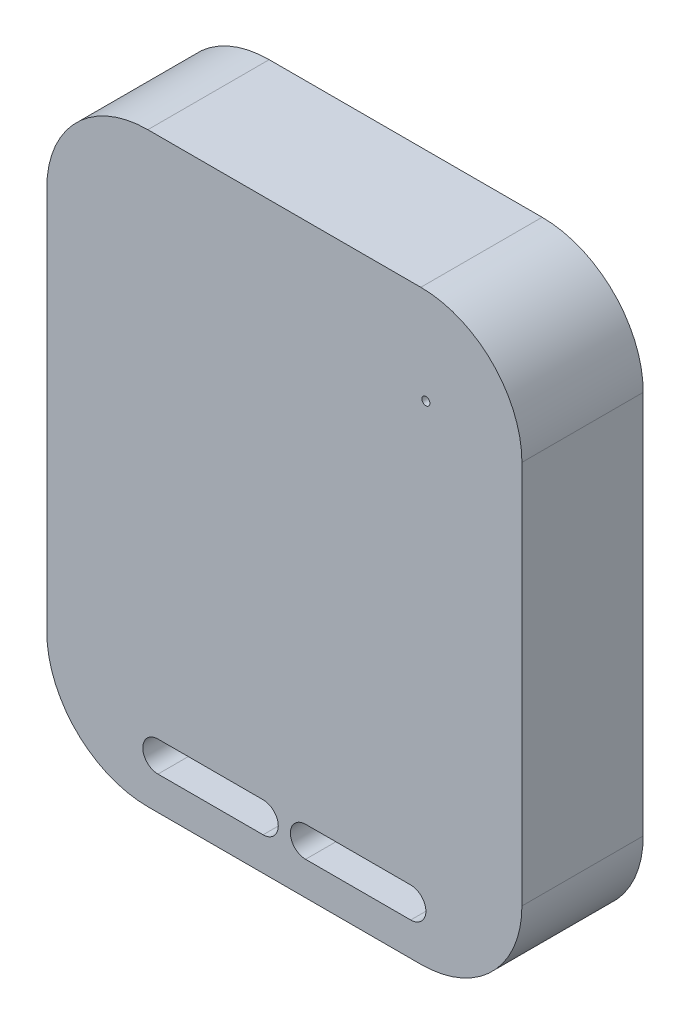
from build123d import *

# Parameters (mm, degrees)
POCKET_TAG_BODY_58X47X12_R10_DEPTH         = 12
LANYARD_SLOT_LEFT_REAL_DEPTH               = 12.5
LANYARD_SLOT_RIGHT_REAL_DEPTH              = 12.5
SKETCH_4_R                                 = 0.4
STATUS_LED_HOLE_REAL_DEPTH                 = 12.5
USB_C_SIDE_OPENING_9X3_2_AT_PCB_USB1_DEPTH = 5
DIRECTION_MARKER_RECESS_DEPTH              = 0.22
ENGRAVED_LOGO_POYU_DEPTH                   = 0.28
ENGRAVED_LOGO_POCKET_TAG_DEPTH             = 0.22


with BuildPart() as part:
    # 草图1 → Pocket_Tag_body_58x47x12_R10 (new body)
    with BuildSketch(Plane.XY):
        with BuildLine():
            Line((-13.5, 29), (13.5, 29))
            ThreePointArc((13.5, 29), (20.571067812, 26.071067812), (23.5, 19))
            Line((23.5, 19), (23.5, -19))
            ThreePointArc((23.5, -19), (20.571067812, -26.071067812), (13.5, -29))
            Line((13.5, -29), (-13.5, -29))
            ThreePointArc((-13.5, -29), (-20.571067812, -26.071067812), (-23.5, -19))
            Line((-23.5, -19), (-23.5, 19))
            ThreePointArc((-23.5, 19), (-20.571067812, 26.071067812), (-13.5, 29))
        make_face()
    extrude(amount=POCKET_TAG_BODY_58X47X12_R10_DEPTH)

    # 草图2 → Lanyard_slot_left_real (cut)
    with BuildSketch(Plane.XY):
        with BuildLine():
            Line((-12.5, -22.7), (-2.1, -22.7))
            ThreePointArc((-2.1, -22.7), (-0.6, -24.2), (-2.1, -25.7))
            Line((-2.1, -25.7), (-12.5, -25.7))
            ThreePointArc((-12.5, -25.7), (-14, -24.2), (-12.5, -22.7))
        make_face()
    extrude(amount=LANYARD_SLOT_LEFT_REAL_DEPTH, mode=Mode.SUBTRACT)

    # 草图3 → Lanyard_slot_right_real (cut)
    with BuildSketch(Plane.XY):
        with BuildLine():
            Line((2.1, -22.7), (12.5, -22.7))
            ThreePointArc((12.5, -22.7), (14, -24.2), (12.5, -25.7))
            Line((12.5, -25.7), (2.1, -25.7))
            ThreePointArc((2.1, -25.7), (0.6, -24.2), (2.1, -22.7))
        make_face()
    extrude(amount=LANYARD_SLOT_RIGHT_REAL_DEPTH, mode=Mode.SUBTRACT)

    # 草图4 → Status_LED_hole_real (cut)
    with BuildSketch(Plane.XY):
        with Locations(Location((14, 19.5, 0), (0, 0, 180))):
            Circle(SKETCH_4_R)
    extrude(amount=STATUS_LED_HOLE_REAL_DEPTH, mode=Mode.SUBTRACT)

    # 草图5 → USB_C_side_opening_9x3_2_at_PCB_USB1 (cut)
    with BuildSketch(Plane(origin=(0, 0, 0), x_dir=(-1, 0, 0), z_dir=(0, 0, -1))):
        with BuildLine():
            Line((-2.9, 1.6), (2.9, 1.6))
            ThreePointArc((2.9, 1.6), (4.5, 0), (2.9, -1.6))
            Line((2.9, -1.6), (-2.9, -1.6))
            ThreePointArc((-2.9, -1.6), (-4.5, 0), (-2.9, 1.6))
        make_face()
    extrude(amount=-USB_C_SIDE_OPENING_9X3_2_AT_PCB_USB1_DEPTH, mode=Mode.SUBTRACT)

    # 草图6 → Direction_marker_recess (cut)
    with BuildSketch(Plane.XY):
        Polygon((-19, 20.9), (-17.4, 21.7), (-17.4, 25.1), (-19, 24.3), align=None)
    extrude(amount=DIRECTION_MARKER_RECESS_DEPTH, mode=Mode.SUBTRACT)

    # 草图7 → Engraved_Logo_POYU (cut)
    # profile 1 of 4: a face of its own
    with BuildSketch(Plane.XY):
        with BuildLine():
            Line((-6.623076923, 2.8), (-6.623076923, 7.8))
            Line((-6.623076923, 7.8), (-4.786137821, 7.8))
            add(Edge.make_bspline(
                [(-4.786137821, 7.8), (-4.709998175, 7.799566226), (-4.567007564, 7.798751597), (-4.367323014, 7.789211242), (-4.195850647, 7.777408243), (-4.092280648, 7.760603842), (-4.044951923, 7.752924679)],
                knots=[0, 0, 0, 0, 1.22865052, 2.30741144, 3.226532197, 4, 4, 4, 4], degree=3))
            add(Edge.make_bspline(
                [(-4.044951923, 7.752924679), (-3.987222303, 7.741814485), (-3.875326209, 7.720279832), (-3.716898682, 7.668364453), (-3.572562028, 7.603759728), (-3.442541816, 7.523268906), (-3.32467801, 7.428711879), (-3.220650303, 7.315410364), (-3.128437593, 7.185894184), (-3.05002862, 7.040264678), (-2.984765165, 6.883567391), (-2.939054387, 6.716630562), (-2.909776551, 6.542354488), (-2.906694864, 6.4232502), (-2.905128205, 6.362700321)],
                knots=[0, 0, 0, 0, 1.070909925, 2.075721949, 3.031861647, 3.947440733, 4.85625699, 5.777986723, 6.742441087, 7.747548058, 8.78749499, 9.830146138, 10.896896232, 12, 12, 12, 12], degree=3))
            add(Edge.make_bspline(
                [(-2.905128205, 6.362700321), (-2.906232294, 6.310893866), (-2.90840465, 6.20896183), (-2.927058325, 6.059208957), (-2.956479203, 5.915140605), (-3.000364433, 5.777742655), (-3.054015305, 5.645408791), (-3.121627801, 5.520370854), (-3.20058012, 5.400930935), (-3.291162931, 5.287414041), (-3.397804058, 5.182123687), (-3.526106444, 5.092805522), (-3.673596405, 5.017803371), (-3.840308342, 4.957202445), (-4.025837558, 4.909519281), (-4.230791945, 4.874582505), (-4.45557076, 4.855294497), (-4.611822835, 4.852653783), (-4.692988782, 4.851282051)],
                knots=[0, 0, 0, 0, 0.928769099, 1.82740408, 2.702266355, 3.562020322, 4.410419678, 5.259600434, 6.10654066, 6.975254961, 7.860221694, 8.783881459, 9.766664779, 10.81996744, 11.958551584, 13.197863772, 14.544415867, 16, 16, 16, 16], degree=3))
            Line((-4.692988782, 4.851282051), (-5.917948718, 4.851282051))
            Line((-5.917948718, 4.851282051), (-5.917948718, 2.8))
            Line((-5.917948718, 2.8), (-6.623076923, 2.8))
        make_face()
        with BuildLine():
            Line((-5.917948718, 5.428205128), (-4.712019231, 5.428205128))
            add(Edge.make_bspline(
                [(-4.712019231, 5.428205128), (-4.663922024, 5.429009332), (-4.571267213, 5.430558555), (-4.437385236, 5.44136988), (-4.314514618, 5.460083783), (-4.202314525, 5.4861842), (-4.100642092, 5.518626269), (-4.00967923, 5.559656557), (-3.929895007, 5.608874719), (-3.860760753, 5.665779217), (-3.801416798, 5.729526138), (-3.749996672, 5.79907051), (-3.706307353, 5.874909307), (-3.67206009, 5.957359831), (-3.643047936, 6.04481826), (-3.624939115, 6.139096737), (-3.612348108, 6.238828087), (-3.610963419, 6.307569557), (-3.61025641, 6.342668269)],
                knots=[0, 0, 0, 0, 1.403696362, 2.704090955, 3.91683431, 5.027708188, 6.063065288, 7.026749679, 7.932587242, 8.790956304, 9.632005367, 10.468072405, 11.310475089, 12.179234342, 13.069796908, 13.994719932, 14.976123913, 16, 16, 16, 16], degree=3))
            add(Edge.make_bspline(
                [(-3.61025641, 6.342668269), (-3.611750062, 6.393567), (-3.614644238, 6.492190969), (-3.643803782, 6.634107823), (-3.689519786, 6.765241512), (-3.754971651, 6.883109263), (-3.834187445, 6.986510674), (-3.927303933, 7.071110049), (-4.031335773, 7.138744131), (-4.109010893, 7.165523929), (-4.148116987, 7.17900641)],
                knots=[0, 0, 0, 0, 1.143156811, 2.215038775, 3.243253804, 4.254666983, 5.233799895, 6.158487526, 7.072877374, 8, 8, 8, 8], degree=3))
            add(Edge.make_bspline(
                [(-4.148116987, 7.17900641), (-4.162438892, 7.182508432), (-4.193561377, 7.190118568), (-4.245115528, 7.198756186), (-4.304864074, 7.206935243), (-4.373098258, 7.212361666), (-4.449195801, 7.217750796), (-4.533389343, 7.22023505), (-4.625870676, 7.222380737), (-4.69031613, 7.222837771), (-4.724038462, 7.223076923)],
                knots=[0, 0, 0, 0, 0.611063981, 1.327884044, 2.165719042, 3.110592661, 4.16481496, 5.328235826, 6.601947678, 8, 8, 8, 8], degree=3))
            Line((-4.724038462, 7.223076923), (-5.917948718, 7.223076923))
            Line((-5.917948718, 7.223076923), (-5.917948718, 5.428205128))
        make_face(mode=Mode.SUBTRACT)
    # profile 2 of 4: a face of its own
    with BuildSketch(Plane.XY):
        with BuildLine():
            add(Edge.make_bspline(
                [(-2.264102564, 5.233894231), (-2.262364757, 5.334139921), (-2.258978727, 5.529463565), (-2.227341224, 5.813879959), (-2.17597004, 6.081478582), (-2.102530387, 6.332238585), (-2.009445416, 6.566552913), (-1.896282851, 6.784952134), (-1.759638838, 6.984964125), (-1.605059639, 7.168492871), (-1.432401773, 7.330745735), (-1.248570221, 7.474849524), (-1.051269501, 7.595049121), (-0.842322522, 7.694294361), (-0.620841558, 7.770491983), (-0.38744846, 7.823837251), (-0.14239284, 7.858250134), (0.025108411, 7.862123418), (0.110697115, 7.864102564)],
                knots=[0, 0, 0, 0, 1.203621547, 2.345195544, 3.432004029, 4.472479546, 5.478447225, 6.455936844, 7.420185704, 8.381829745, 9.332027588, 10.260832629, 11.182364398, 12.100723901, 13.034044877, 13.989196293, 14.972532542, 16, 16, 16, 16], degree=3))
            add(Edge.make_bspline(
                [(0.110697115, 7.864102564), (0.167148747, 7.863116812), (0.279251478, 7.861159288), (0.444985361, 7.846265139), (0.606460465, 7.819681663), (0.763517779, 7.784056825), (0.916584814, 7.737318586), (1.065752978, 7.682145518), (1.209716471, 7.613778317), (1.349433043, 7.537234433), (1.483253444, 7.451616788), (1.609017522, 7.35703515), (1.726424032, 7.254204836), (1.837050062, 7.144816094), (1.937204177, 7.025177208), (2.031023998, 6.898932584), (2.115813558, 6.763843699), (2.191873708, 6.621017378), (2.259879211, 6.472659548), (2.318003046, 6.318155325), (2.367912923, 6.159358097), (2.4096917, 5.995327953), (2.4396691, 5.82612097), (2.463540428, 5.652466244), (2.476104567, 5.473796213), (2.47835013, 5.353101423), (2.479487179, 5.291987179)],
                knots=[0, 0, 0, 0, 1.034375294, 2.054082248, 3.045783978, 4.031219655, 5.002789406, 5.976610191, 6.94273282, 7.920236376, 8.894345378, 9.851183672, 10.800797181, 11.752517031, 12.698794154, 13.65688337, 14.632873302, 15.61821402, 16.620222298, 17.621258913, 18.640965868, 19.669244166, 20.720417492, 21.788124603, 22.880008887, 24, 24, 24, 24], degree=3))
            add(Edge.make_bspline(
                [(2.479487179, 5.291987179), (2.478445395, 5.229865161), (2.47638717, 5.107132401), (2.462460377, 4.925818563), (2.437972236, 4.749709869), (2.405492885, 4.578281196), (2.361971546, 4.411889421), (2.310253123, 4.25005749), (2.247696769, 4.093749305), (2.177046311, 3.942588132), (2.097105349, 3.798652961), (2.008925043, 3.662950256), (1.912442924, 3.536749406), (1.809124544, 3.418502251), (1.696557144, 3.310323271), (1.576126839, 3.211200912), (1.448296682, 3.120200338), (1.312637229, 3.03978613), (1.171583073, 2.969300204), (1.027925456, 2.906766489), (0.881557663, 2.853435248), (0.731979455, 2.810215578), (0.579598867, 2.777555685), (0.424844715, 2.753099612), (0.267209695, 2.739017721), (0.161138005, 2.736942876), (0.107692308, 2.735897436)],
                knots=[0, 0, 0, 0, 1.141429366, 2.255090526, 3.338676798, 4.407031443, 5.458968682, 6.496860253, 7.526652771, 8.550250826, 9.560787671, 10.54935636, 11.521089193, 12.477323897, 13.431786008, 14.386110112, 15.340986122, 16.312041, 17.28047646, 18.236612773, 19.189437236, 20.140779471, 21.09494583, 22.051062463, 23.018000708, 24, 24, 24, 24], degree=3))
            add(Edge.make_bspline(
                [(0.107692308, 2.735897436), (0.050226313, 2.736747652), (-0.06359943, 2.738431718), (-0.231836945, 2.755241567), (-0.395888974, 2.780885578), (-0.55527859, 2.817907781), (-0.709787993, 2.866205862), (-0.859600003, 2.92466433), (-1.005241525, 2.992501907), (-1.144905388, 3.071661004), (-1.278116234, 3.159677412), (-1.403582935, 3.256113603), (-1.521236112, 3.360080834), (-1.629187914, 3.473297558), (-1.73093456, 3.591659626), (-1.822407761, 3.719566481), (-1.90659489, 3.854117331), (-1.981004712, 3.996609187), (-2.04822285, 4.142807732), (-2.104855584, 4.29275973), (-2.154624781, 4.444255288), (-2.194260908, 4.598228161), (-2.225846078, 4.754323168), (-2.247084816, 4.912280574), (-2.262423595, 5.072335628), (-2.263540091, 5.179770357), (-2.264102564, 5.233894231)],
                knots=[0, 0, 0, 0, 1.072727997, 2.12480551, 3.153819198, 4.171534612, 5.177148798, 6.173931848, 7.17235114, 8.174500385, 9.168706755, 10.151274001, 11.127173509, 12.097141049, 13.070188938, 14.039134204, 15.03036519, 16.031505612, 17.038625933, 18.033164522, 19.022845559, 20.014762458, 21.000193215, 21.994692725, 22.989758729, 24, 24, 24, 24], degree=3))
        make_face()
        with BuildLine():
            add(Edge.make_bspline(
                [(-1.558974359, 5.22588141), (-1.557893783, 5.153695468), (-1.555786737, 5.012937976), (-1.53168099, 4.807721037), (-1.495104368, 4.614088405), (-1.444687355, 4.431496506), (-1.376914544, 4.261751146), (-1.295883373, 4.103221238), (-1.198865504, 3.956960598), (-1.08800144, 3.823378376), (-0.96606368, 3.703378117), (-0.835760807, 3.598564274), (-0.697063532, 3.510790094), (-0.55150956, 3.438313771), (-0.398053445, 3.381739393), (-0.237154789, 3.342014289), (-0.068695374, 3.317169462), (0.046173173, 3.314288223), (0.1046875, 3.312820513)],
                knots=[0, 0, 0, 0, 1.215430442, 2.370003584, 3.475209778, 4.53279855, 5.55522989, 6.548792651, 7.526809858, 8.505409025, 9.467826767, 10.404123909, 11.316848639, 12.227335424, 13.138360512, 14.065900994, 15.014765094, 16, 16, 16, 16], degree=3))
            add(Edge.make_bspline(
                [(0.1046875, 3.312820513), (0.164193648, 3.314309932), (0.280706517, 3.317226209), (0.451705686, 3.341637325), (0.61417404, 3.383196208), (0.769721928, 3.438520496), (0.915537197, 3.513309503), (1.055030048, 3.60088702), (1.184397889, 3.707904237), (1.306816334, 3.828116729), (1.416617432, 3.964760305), (1.514042792, 4.114468998), (1.593184296, 4.279488058), (1.661512304, 4.456182341), (1.711546009, 4.647891437), (1.748523983, 4.852435997), (1.770807693, 5.070473977), (1.773154283, 5.220153006), (1.774358974, 5.296995192)],
                knots=[0, 0, 0, 0, 0.976878588, 1.912725521, 2.8289017, 3.727303729, 4.617335839, 5.514666588, 6.426584173, 7.368641557, 8.327632997, 9.299405846, 10.294892156, 11.327373912, 12.405931897, 13.542618837, 14.738430195, 16, 16, 16, 16], degree=3))
            add(Edge.make_bspline(
                [(1.774358974, 5.296995192), (1.773933237, 5.346430454), (1.773098094, 5.443404547), (1.762038001, 5.586345469), (1.747771901, 5.724840111), (1.726051541, 5.858709763), (1.69611813, 5.987400043), (1.662956994, 6.11189067), (1.621490152, 6.231108854), (1.574440241, 6.345522123), (1.521792188, 6.4545431), (1.462412186, 6.557252696), (1.396990353, 6.653251598), (1.327291845, 6.744359848), (1.249457155, 6.827051184), (1.167234067, 6.904818526), (1.078754889, 6.976055184), (0.984902609, 7.040779766), (0.887008643, 7.09904209), (0.785274801, 7.14890708), (0.681321845, 7.192707209), (0.573409752, 7.226281846), (0.463028579, 7.253360283), (0.349732106, 7.273928878), (0.233099807, 7.284580254), (0.154452359, 7.286306854), (0.114703526, 7.287179487)],
                knots=[0, 0, 0, 0, 1.220438779, 2.394059227, 3.538503547, 4.658058814, 5.74010225, 6.800155734, 7.837851593, 8.854470756, 9.853724944, 10.825214244, 11.781044712, 12.72106398, 13.654479919, 14.581868691, 15.514082315, 16.456304431, 17.39516604, 18.324312202, 19.252140633, 20.177768678, 21.111585046, 22.057694709, 23.018348693, 24, 24, 24, 24], degree=3))
            add(Edge.make_bspline(
                [(0.114703526, 7.287179487), (0.058523971, 7.286063783), (-0.052324549, 7.283862376), (-0.215506767, 7.259390309), (-0.372832118, 7.222825698), (-0.524544755, 7.171706423), (-0.669347101, 7.10401647), (-0.807989367, 7.021004005), (-0.941702205, 6.924929328), (-1.068377154, 6.813451601), (-1.186465915, 6.685390906), (-1.286298115, 6.53441127), (-1.37043942, 6.364116895), (-1.440695861, 6.174939437), (-1.494264327, 5.965413843), (-1.531286838, 5.736441798), (-1.554662096, 5.487782023), (-1.55750019, 5.315413447), (-1.558974359, 5.22588141)],
                knots=[0, 0, 0, 0, 0.895090134, 1.766112571, 2.624765742, 3.468151641, 4.313618154, 5.168136083, 6.041303099, 6.935189387, 7.854749729, 8.809996334, 9.809869957, 10.877771942, 12.021723904, 13.25217762, 14.572720513, 16, 16, 16, 16], degree=3))
        make_face(mode=Mode.SUBTRACT)
    # profile 3 of 4: a face of its own
    with BuildSketch(Plane.XY):
        with BuildLine():
            Line((4.730088141, 2.8), (4.730088141, 4.918389423))
            Line((4.730088141, 4.918389423), (2.807011218, 7.8))
            Line((2.807011218, 7.8), (3.641346154, 7.8))
            Line((3.641346154, 7.8), (4.610897436, 6.271554487))
            add(Edge.make_bspline(
                [(4.610897436, 6.271554487), (4.654335875, 6.203468191), (4.738623526, 6.071354006), (4.860434728, 5.879135843), (4.975269127, 5.699594712), (5.048330184, 5.583495562), (5.083653846, 5.527363782)],
                knots=[0, 0, 0, 0, 1.099240192, 2.132958167, 3.097319992, 4, 4, 4, 4], degree=3))
            add(Edge.make_bspline(
                [(5.083653846, 5.527363782), (5.119081689, 5.582761673), (5.194779704, 5.701129319), (5.314611402, 5.89032784), (5.449167578, 6.101783278), (5.543101131, 6.250491936), (5.592467949, 6.328645833)],
                knots=[0, 0, 0, 0, 0.831336673, 1.776301659, 2.8313344, 4, 4, 4, 4], degree=3))
            Line((5.592467949, 6.328645833), (6.523958333, 7.8))
            Line((6.523958333, 7.8), (7.358293269, 7.8))
            Line((7.358293269, 7.8), (5.435216346, 4.918389423))
            Line((5.435216346, 4.918389423), (5.435216346, 2.8))
            Line((5.435216346, 2.8), (4.730088141, 2.8))
        make_face()
    # profile 4 of 4: a face of its own
    with BuildSketch(Plane.XY):
        with BuildLine():
            Line((11.069230769, 7.8), (11.774358974, 7.8))
            Line((11.774358974, 7.8), (11.774358974, 4.923397436))
            add(Edge.make_bspline(
                [(11.774358974, 4.923397436), (11.773627224, 4.862294527), (11.772203235, 4.743388167), (11.765652276, 4.569976732), (11.752890712, 4.406200917), (11.73335304, 4.252325588), (11.711265635, 4.107683348), (11.681848639, 3.973064945), (11.648109756, 3.847927066), (11.609290032, 3.731424253), (11.562302363, 3.622769442), (11.508618814, 3.519635918), (11.446015134, 3.421722567), (11.374653689, 3.329177999), (11.294155849, 3.242508066), (11.206719695, 3.159491063), (11.110037111, 3.082409165), (11.005171672, 3.010380005), (10.891993156, 2.945007846), (10.770006091, 2.888607149), (10.639359288, 2.842106098), (10.500642682, 2.802546058), (10.353163766, 2.773216535), (10.19739566, 2.750969534), (10.033132138, 2.737884151), (9.92074992, 2.736569481), (9.863301282, 2.735897436)],
                knots=[0, 0, 0, 0, 1.311435591, 2.552055809, 3.723716842, 4.835547674, 5.880436826, 6.862821995, 7.791032428, 8.661143393, 9.495683908, 10.328993084, 11.1538804, 11.986573222, 12.833449924, 13.690091648, 14.571895854, 15.484149563, 16.418232274, 17.373591634, 18.364096258, 19.391643703, 20.466661433, 21.588422397, 22.767226238, 24, 24, 24, 24], degree=3))
            add(Edge.make_bspline(
                [(9.863301282, 2.735897436), (9.807195679, 2.736723308), (9.69787829, 2.738332456), (9.537683262, 2.749213506), (9.385302594, 2.768495918), (9.240276398, 2.793801281), (9.103091478, 2.828096737), (8.973951501, 2.870074682), (8.85241557, 2.919178303), (8.738469152, 2.975046598), (8.633444301, 3.03954952), (8.535484296, 3.109956973), (8.445027136, 3.187035606), (8.362913134, 3.271480154), (8.288168739, 3.362019007), (8.221835681, 3.459619782), (8.163755124, 3.564456553), (8.112466596, 3.676253261), (8.067780285, 3.796655545), (8.031747015, 3.927304294), (7.999147708, 4.067864167), (7.974127074, 4.218845827), (7.952149143, 4.380059692), (7.939403999, 4.551982205), (7.929693473, 4.734317582), (7.92870983, 4.859279947), (7.928205128, 4.923397436)],
                knots=[0, 0, 0, 0, 1.192889473, 2.324252067, 3.41162405, 4.457325556, 5.452435892, 6.415456921, 7.342133401, 8.237363544, 9.110250727, 9.959377435, 10.800155199, 11.633438097, 12.46053001, 13.293359256, 14.138649731, 15.005774073, 15.906391469, 16.865847877, 17.8852706, 18.972920589, 20.118424796, 21.343408205, 22.636917643, 24, 24, 24, 24], degree=3))
            Line((7.928205128, 4.923397436), (7.928205128, 7.8))
            Line((7.928205128, 7.8), (8.633333333, 7.8))
            Line((8.633333333, 7.8), (8.633333333, 4.956450321))
            add(Edge.make_bspline(
                [(8.633333333, 4.956450321), (8.633794073, 4.904698336), (8.634683076, 4.804842119), (8.639321326, 4.660189171), (8.648597017, 4.525952109), (8.660064226, 4.401926006), (8.675829517, 4.288558742), (8.696018668, 4.186016348), (8.718664183, 4.093949614), (8.752575542, 3.986281983), (8.808865192, 3.866093734), (8.897573655, 3.738704019), (9.00581562, 3.628033178), (9.134626763, 3.536636527), (9.280906288, 3.464015087), (9.443668105, 3.413941707), (9.620981262, 3.381739612), (9.744294506, 3.378567382), (9.808213141, 3.376923077)],
                knots=[0, 0, 0, 0, 1.090245215, 2.103644224, 3.048223674, 3.924421557, 4.727106666, 5.45815927, 6.12513286, 6.723455763, 7.834131158, 8.905266051, 9.9795367, 11.078391299, 12.21701853, 13.404826756, 14.65480846, 16, 16, 16, 16], degree=3))
            add(Edge.make_bspline(
                [(9.808213141, 3.376923077), (9.862996056, 3.377855701), (9.968776319, 3.379656504), (10.121308453, 3.394179357), (10.261143935, 3.420654821), (10.389443327, 3.454773059), (10.505303762, 3.501107402), (10.609433644, 3.557244085), (10.701467597, 3.623485207), (10.782066031, 3.701625358), (10.851512197, 3.795134733), (10.910042717, 3.906575224), (10.95990369, 4.03604395), (11.000764118, 4.183968316), (11.030557094, 4.35105089), (11.05384723, 4.536215556), (11.066059431, 4.740276366), (11.068143225, 4.882317995), (11.069230769, 4.956450321)],
                knots=[0, 0, 0, 0, 1.111629428, 2.146443922, 3.104513091, 3.997025448, 4.836178689, 5.630482806, 6.392099463, 7.129930272, 7.899580577, 8.745272349, 9.676297551, 10.710246713, 11.854352966, 13.117392195, 14.495550762, 16, 16, 16, 16], degree=3))
            Line((11.069230769, 4.956450321), (11.069230769, 7.8))
        make_face()
    extrude(amount=ENGRAVED_LOGO_POYU_DEPTH, mode=Mode.SUBTRACT)

    # 草图8 → Engraved_Logo_Pocket_Tag (cut)
    # profile 1 of 9: a face of its own
    with BuildSketch(Plane.XY):
        with BuildLine():
            Line((-4.857692308, -2.6), (-4.857692308, -0.5))
            Line((-4.857692308, -0.5), (-4.086177885, -0.5))
            add(Edge.make_bspline(
                [(-4.086177885, -0.5), (-4.054199234, -0.500182185), (-3.994143177, -0.500524329), (-3.910275666, -0.504531279), (-3.838257272, -0.509488538), (-3.794757872, -0.516546386), (-3.774879808, -0.519771635)],
                knots=[0, 0, 0, 0, 1.22865052, 2.30741144, 3.226532197, 4, 4, 4, 4], degree=3))
            add(Edge.make_bspline(
                [(-3.774879808, -0.519771635), (-3.750633367, -0.524437916), (-3.703637008, -0.533482471), (-3.637097447, -0.55528693), (-3.576476052, -0.582420914), (-3.521867563, -0.616227059), (-3.472364764, -0.655941011), (-3.428673127, -0.703527647), (-3.389943789, -0.757924443), (-3.357012021, -0.819088835), (-3.329601369, -0.884901696), (-3.310402842, -0.955015164), (-3.298106151, -1.028211115), (-3.296811843, -1.078234916), (-3.296153846, -1.103665865)],
                knots=[0, 0, 0, 0, 1.070909925, 2.075721949, 3.031861647, 3.947440733, 4.85625699, 5.777986723, 6.742441087, 7.747548058, 8.78749499, 9.830146138, 10.896896232, 12, 12, 12, 12], degree=3))
            add(Edge.make_bspline(
                [(-3.296153846, -1.103665865), (-3.296617564, -1.125424576), (-3.297529953, -1.168236032), (-3.305364497, -1.231132238), (-3.317721265, -1.291640946), (-3.336153062, -1.349348085), (-3.358686428, -1.404928308), (-3.387083676, -1.457444241), (-3.42024365, -1.507609007), (-3.458288431, -1.555286103), (-3.503077704, -1.599508051), (-3.556964706, -1.637021681), (-3.61891049, -1.668522584), (-3.688929504, -1.693974973), (-3.766851774, -1.714001902), (-3.852932617, -1.728675348), (-3.947339719, -1.736776311), (-4.012965591, -1.737885411), (-4.047055288, -1.738461538)],
                knots=[0, 0, 0, 0, 0.928769099, 1.82740408, 2.702266355, 3.562020322, 4.410419678, 5.259600434, 6.10654066, 6.975254961, 7.860221694, 8.783881459, 9.766664779, 10.81996744, 11.958551584, 13.197863772, 14.544415867, 16, 16, 16, 16], degree=3))
            Line((-4.047055288, -1.738461538), (-4.561538462, -1.738461538))
            Line((-4.561538462, -1.738461538), (-4.561538462, -2.6))
            Line((-4.561538462, -2.6), (-4.857692308, -2.6))
        make_face()
        with BuildLine():
            Line((-4.561538462, -1.496153846), (-4.055048077, -1.496153846))
            add(Edge.make_bspline(
                [(-4.055048077, -1.496153846), (-4.03484725, -1.495816081), (-3.995932229, -1.495165407), (-3.939701799, -1.490624651), (-3.888096139, -1.482764811), (-3.840972101, -1.471802636), (-3.798269679, -1.458176967), (-3.760065277, -1.440944246), (-3.726555903, -1.420272618), (-3.697519516, -1.396372729), (-3.672595055, -1.369599022), (-3.650998602, -1.340390386), (-3.632649088, -1.308538091), (-3.618265238, -1.273908871), (-3.606080133, -1.237176331), (-3.598474428, -1.19757937), (-3.593186205, -1.155692204), (-3.592604636, -1.126820786), (-3.592307692, -1.112079327)],
                knots=[0, 0, 0, 0, 1.403696362, 2.704090955, 3.91683431, 5.027708188, 6.063065288, 7.026749679, 7.932587242, 8.790956304, 9.632005367, 10.468072405, 11.310475089, 12.179234342, 13.069796908, 13.994719932, 14.976123913, 16, 16, 16, 16], degree=3))
            add(Edge.make_bspline(
                [(-3.592307692, -1.112079327), (-3.592935026, -1.09070186), (-3.59415058, -1.049279793), (-3.606397588, -0.989674714), (-3.62559831, -0.934598565), (-3.653088093, -0.885094109), (-3.686358727, -0.841665517), (-3.725467652, -0.806133779), (-3.769161025, -0.777727465), (-3.801784575, -0.76647995), (-3.818209135, -0.760817308)],
                knots=[0, 0, 0, 0, 1.143156811, 2.215038775, 3.243253804, 4.254666983, 5.233799895, 6.158487526, 7.072877374, 8, 8, 8, 8], degree=3))
            add(Edge.make_bspline(
                [(-3.818209135, -0.760817308), (-3.824224335, -0.759346458), (-3.837295778, -0.756150202), (-3.858948522, -0.752522402), (-3.884042911, -0.749087198), (-3.912701268, -0.7468081), (-3.944662236, -0.744544666), (-3.980023524, -0.743501279), (-4.018865684, -0.74260009), (-4.045932775, -0.742408136), (-4.060096154, -0.742307692)],
                knots=[0, 0, 0, 0, 0.611063981, 1.327884044, 2.165719042, 3.110592661, 4.16481496, 5.328235826, 6.601947678, 8, 8, 8, 8], degree=3))
            Line((-4.060096154, -0.742307692), (-4.561538462, -0.742307692))
            Line((-4.561538462, -0.742307692), (-4.561538462, -1.496153846))
        make_face(mode=Mode.SUBTRACT)
    # profile 2 of 9: a face of its own
    with BuildSketch(Plane.XY):
        with BuildLine():
            add(Edge.make_bspline(
                [(-3.053846154, -1.832692308), (-3.053092257, -1.798591368), (-3.051633411, -1.732603561), (-3.041186777, -1.636850171), (-3.023276786, -1.547953291), (-2.998142569, -1.465829428), (-2.965639044, -1.390452708), (-2.925485048, -1.32224604), (-2.87878802, -1.259956349), (-2.84152113, -1.224747441), (-2.822896635, -1.207151442)],
                knots=[0, 0, 0, 0, 1.189940866, 2.302622481, 3.356378305, 4.350088409, 5.294652018, 6.213657312, 7.107257627, 8, 8, 8, 8], degree=3))
            add(Edge.make_bspline(
                [(-2.822896635, -1.207151442), (-2.806607057, -1.193628756), (-2.774325127, -1.166830123), (-2.721635021, -1.132845277), (-2.666778755, -1.103646464), (-2.609271603, -1.079436188), (-2.548931816, -1.060938661), (-2.485947289, -1.048100552), (-2.420398526, -1.039713118), (-2.375747668, -1.0388839), (-2.353004808, -1.038461538)],
                knots=[0, 0, 0, 0, 0.994414631, 1.970684744, 2.940793954, 3.912782355, 4.898970837, 5.902128985, 6.931451948, 8, 8, 8, 8], degree=3))
            add(Edge.make_bspline(
                [(-2.353004808, -1.038461538), (-2.327881947, -1.03917034), (-2.278724413, -1.040557243), (-2.206588375, -1.04960136), (-2.138280495, -1.066408541), (-2.072921229, -1.088436066), (-2.011500269, -1.117791444), (-1.953047497, -1.152789073), (-1.898994198, -1.195203381), (-1.848304402, -1.243144724), (-1.802576322, -1.296758934), (-1.762736151, -1.355782578), (-1.728997223, -1.419705783), (-1.70112701, -1.488589153), (-1.679753455, -1.562480839), (-1.664855542, -1.641222934), (-1.65531183, -1.724624708), (-1.654342545, -1.781904042), (-1.653846154, -1.811237981)],
                knots=[0, 0, 0, 0, 1.026363227, 2.008269884, 2.962742747, 3.895658536, 4.820662428, 5.738204837, 6.673158329, 7.621267452, 8.584296177, 9.545483285, 10.524327568, 11.531652541, 12.575780624, 13.660990097, 14.802144351, 16, 16, 16, 16], degree=3))
            add(Edge.make_bspline(
                [(-1.653846154, -1.811237981), (-1.654033185, -1.835083351), (-1.654396562, -1.881411712), (-1.658788957, -1.948916136), (-1.665426532, -2.012504992), (-1.674460424, -2.072250652), (-1.686629512, -2.12805732), (-1.70180453, -2.179880188), (-1.719403025, -2.227999136), (-1.739629303, -2.272465524), (-1.76270832, -2.313638556), (-1.787851171, -2.352405648), (-1.815689894, -2.388707988), (-1.846188803, -2.422485413), (-1.878936339, -2.453982891), (-1.914155936, -2.483319826), (-1.951912608, -2.510073866), (-2.005217501, -2.542556844), (-2.075573327, -2.576595482), (-2.164682502, -2.605765878), (-2.257647021, -2.623545055), (-2.320955833, -2.625787751), (-2.353004808, -2.626923077)],
                knots=[0, 0, 0, 0, 1.174068422, 2.28105775, 3.329581501, 4.321819531, 5.255045276, 6.14001734, 6.978936381, 7.776151739, 8.542754425, 9.301196708, 10.049767304, 10.792968067, 11.540167917, 12.285482871, 13.048063169, 13.816653646, 15.357768987, 16.884132754, 18.422646949, 20, 20, 20, 20], degree=3))
            add(Edge.make_bspline(
                [(-2.353004808, -2.626923077), (-2.378552599, -2.626230186), (-2.428556786, -2.624874004), (-2.501713067, -2.615620961), (-2.571142843, -2.599765798), (-2.636636679, -2.576660436), (-2.698778297, -2.548297509), (-2.756980468, -2.512890791), (-2.811355656, -2.471211762), (-2.861423647, -2.422991537), (-2.907202539, -2.369304552), (-2.946280632, -2.30899805), (-2.979726703, -2.243315887), (-3.007052083, -2.171974793), (-3.027924861, -2.094972619), (-3.042914085, -2.012512081), (-3.052388726, -1.924479815), (-3.053351469, -1.863847138), (-3.053846154, -1.832692308)],
                knots=[0, 0, 0, 0, 1.022681766, 2.001674804, 2.94671416, 3.868132449, 4.777362857, 5.676573364, 6.589418535, 7.514523194, 8.454681358, 9.407574523, 10.384198733, 11.400667853, 12.460217505, 13.573389442, 14.753137007, 16, 16, 16, 16], degree=3))
        make_face()
        with BuildLine():
            add(Edge.make_bspline(
                [(-2.784615385, -1.831850962), (-2.784158481, -1.854296276), (-2.783274678, -1.897712958), (-2.778000087, -1.9607307), (-2.768364379, -2.019235066), (-2.754958894, -2.073438604), (-2.737764778, -2.123349002), (-2.716691469, -2.169050759), (-2.691968872, -2.210582618), (-2.663060529, -2.247267515), (-2.6315984, -2.279692892), (-2.597663876, -2.307662349), (-2.561728883, -2.331411902), (-2.523732348, -2.350776602), (-2.483846337, -2.366076455), (-2.44198407, -2.377092627), (-2.398071308, -2.383418141), (-2.368169082, -2.384212528), (-2.353004808, -2.384615385)],
                knots=[0, 0, 0, 0, 1.36128903, 2.633184439, 3.831299874, 4.953299848, 6.015607462, 7.027679361, 8.000438392, 8.93945591, 9.853536715, 10.73548639, 11.60109037, 12.460616037, 13.316600729, 14.187036799, 15.080594522, 16, 16, 16, 16], degree=3))
            add(Edge.make_bspline(
                [(-2.353004808, -2.384615385), (-2.337970844, -2.384271824), (-2.308307332, -2.383593946), (-2.264966217, -2.376417198), (-2.223254175, -2.366121432), (-2.183515833, -2.350929431), (-2.146081825, -2.330889804), (-2.110226751, -2.307185583), (-2.076677379, -2.278806914), (-2.044855301, -2.246443666), (-2.016360021, -2.209217474), (-1.990800543, -2.167850096), (-1.969800371, -2.121406071), (-1.952823144, -2.070596604), (-1.939269199, -2.015313516), (-1.929678363, -1.955535696), (-1.924434573, -1.891119557), (-1.923538459, -1.846723832), (-1.923076923, -1.823858173)],
                knots=[0, 0, 0, 0, 0.904535546, 1.784739026, 2.638791991, 3.488785886, 4.338695884, 5.191202824, 6.07237792, 6.980061329, 7.919174549, 8.889507933, 9.902165842, 10.981000531, 12.111539881, 13.326270405, 14.622917219, 16, 16, 16, 16], degree=3))
            add(Edge.make_bspline(
                [(-1.923076923, -1.823858173), (-1.923542349, -1.802254908), (-1.924447528, -1.760240076), (-1.929663079, -1.699168613), (-1.939422635, -1.642239351), (-1.952567399, -1.589291826), (-1.970585614, -1.540762032), (-1.991289172, -1.495729941), (-2.016848702, -1.455088696), (-2.045845694, -1.418609058), (-2.077494693, -1.386144554), (-2.111128638, -1.357653619), (-2.147097888, -1.334255907), (-2.1845359, -1.314363958), (-2.224049007, -1.299500937), (-2.265263802, -1.288258055), (-2.308497838, -1.281953523), (-2.337981224, -1.281168995), (-2.353004808, -1.280769231)],
                knots=[0, 0, 0, 0, 1.329905342, 2.586449315, 3.768451236, 4.882143757, 5.938857988, 6.950440627, 7.927559667, 8.885972819, 9.813736587, 10.714405609, 11.592966897, 12.450023853, 13.318821862, 14.185602452, 15.075453733, 16, 16, 16, 16], degree=3))
            add(Edge.make_bspline(
                [(-2.353004808, -1.280769231), (-2.368167793, -1.281175432), (-2.39806748, -1.281976415), (-2.441998723, -1.28825394), (-2.483745367, -1.299433051), (-2.523834624, -1.314065852), (-2.561690867, -1.333616685), (-2.597833972, -1.357235854), (-2.631301905, -1.385735185), (-2.663239979, -1.417659106), (-2.691816667, -1.454348148), (-2.716707531, -1.495462622), (-2.737848609, -1.540878783), (-2.754946592, -1.590688415), (-2.768367941, -1.64488623), (-2.777999276, -1.703392273), (-2.783262255, -1.766269744), (-2.784155168, -1.809545959), (-2.784615385, -1.831850962)],
                knots=[0, 0, 0, 0, 0.920966903, 1.816042154, 2.687956485, 3.542385364, 4.403370762, 5.270444796, 6.159337503, 7.068888003, 8.009500254, 8.976623456, 9.982690403, 11.046802133, 12.170707598, 13.370857791, 14.644913259, 16, 16, 16, 16], degree=3))
        make_face(mode=Mode.SUBTRACT)
    # profile 3 of 9: a face of its own
    with BuildSketch(Plane.XY):
        with BuildLine():
            Line((-0.388461538, -2.034615385), (-0.119230769, -2.061538462))
            add(Edge.make_bspline(
                [(-0.119230769, -2.061538462), (-0.122956696, -2.083064626), (-0.130275257, -2.125346879), (-0.146892312, -2.186514869), (-0.167327922, -2.244093012), (-0.192006528, -2.298117799), (-0.220389452, -2.348499075), (-0.253115134, -2.39524344), (-0.289899189, -2.43832169), (-0.330413274, -2.47769557), (-0.374449004, -2.512580662), (-0.420631493, -2.543604119), (-0.469722145, -2.569163207), (-0.520921205, -2.590424843), (-0.574610783, -2.606795048), (-0.630750585, -2.618678105), (-0.689365355, -2.625286283), (-0.729191183, -2.626372118), (-0.749399038, -2.626923077)],
                knots=[0, 0, 0, 0, 1.126290047, 2.212288299, 3.264625211, 4.274421374, 5.27199577, 6.243132084, 7.212758999, 8.189695438, 9.152066023, 10.106906036, 11.054818061, 12.001736236, 12.962610873, 13.945632539, 14.95760209, 16, 16, 16, 16], degree=3))
            add(Edge.make_bspline(
                [(-0.749399038, -2.626923077), (-0.774664437, -2.626218886), (-0.82424501, -2.624836989), (-0.896733625, -2.615709738), (-0.965349639, -2.599623323), (-1.03008186, -2.577270037), (-1.091193532, -2.548633193), (-1.148053794, -2.512921782), (-1.201613995, -2.471502385), (-1.250708307, -2.423514962), (-1.295067851, -2.36961346), (-1.333386207, -2.309732637), (-1.366469617, -2.244768035), (-1.392814851, -2.17397449), (-1.41340874, -2.097920151), (-1.427958716, -2.016282382), (-1.436876093, -1.92922541), (-1.437924021, -1.869312859), (-1.438461538, -1.838581731)],
                knots=[0, 0, 0, 0, 1.023197875, 2.007913629, 2.952854009, 3.872368111, 4.776711232, 5.679644676, 6.586124885, 7.513792122, 8.45395957, 9.406953999, 10.38727148, 11.400874437, 12.46026104, 13.574150989, 14.755701814, 16, 16, 16, 16], degree=3))
            add(Edge.make_bspline(
                [(-1.438461538, -1.838581731), (-1.438225291, -1.818383331), (-1.437758934, -1.778511332), (-1.433883807, -1.719696176), (-1.42766677, -1.662829486), (-1.418749153, -1.607949031), (-1.407643548, -1.554904299), (-1.393100458, -1.50405651), (-1.376759927, -1.454977407), (-1.357944912, -1.407988247), (-1.336512726, -1.363180982), (-1.312270327, -1.321194484), (-1.285016786, -1.28227019), (-1.255666754, -1.245834058), (-1.223123786, -1.212629323), (-1.188111385, -1.182216977), (-1.150540666, -1.154763827), (-1.097219687, -1.122448471), (-1.026724818, -1.08887951), (-0.937734147, -1.059589182), (-0.844891667, -1.041874557), (-0.781726717, -1.039606978), (-0.749819712, -1.038461538)],
                knots=[0, 0, 0, 0, 1.013805669, 2.001270362, 2.957354649, 3.884259307, 4.791280502, 5.67595866, 6.537369654, 7.386966453, 8.214944774, 9.028648359, 9.817495426, 10.598008034, 11.374511297, 12.14791384, 12.923651068, 13.707109795, 15.274991334, 16.830882343, 18.399158828, 20, 20, 20, 20], degree=3))
            add(Edge.make_bspline(
                [(-0.749819712, -1.038461538), (-0.729752838, -1.03888198), (-0.690372741, -1.039707072), (-0.632866728, -1.045673309), (-0.577969936, -1.055275657), (-0.526040892, -1.069088869), (-0.47670201, -1.086813803), (-0.430410515, -1.108745161), (-0.386856169, -1.134466803), (-0.346313219, -1.164077114), (-0.308819744, -1.197174565), (-0.275186289, -1.234084386), (-0.244457419, -1.273854367), (-0.217808655, -1.317321391), (-0.19381886, -1.363828895), (-0.174473184, -1.414040824), (-0.157626837, -1.467199259), (-0.150029158, -1.504202734), (-0.146153846, -1.523076923)],
                knots=[0, 0, 0, 0, 1.132709169, 2.22287732, 3.260172152, 4.27594812, 5.252565374, 6.215743486, 7.163376455, 8.103906971, 9.045968701, 9.981589193, 10.918916077, 11.878868217, 12.855998669, 13.868839979, 14.912969196, 16, 16, 16, 16], degree=3))
            Line((-0.146153846, -1.523076923), (-0.415384615, -1.55))
            add(Edge.make_bspline(
                [(-0.415384615, -1.55), (-0.421627692, -1.528739312), (-0.433567991, -1.488076831), (-0.460922298, -1.432628421), (-0.495213005, -1.385735254), (-0.536103283, -1.347309369), (-0.582647696, -1.317668417), (-0.633589432, -1.295919335), (-0.689446994, -1.282974368), (-0.728155618, -1.281519984), (-0.748137019, -1.280769231)],
                knots=[0, 0, 0, 0, 1.141726713, 2.183628378, 3.172002178, 4.124091198, 5.061356818, 6.004746239, 6.970049491, 8, 8, 8, 8], degree=3))
            add(Edge.make_bspline(
                [(-0.748137019, -1.280769231), (-0.763448391, -1.281136042), (-0.793365571, -1.28185276), (-0.83698667, -1.288549703), (-0.878620467, -1.298292121), (-0.917807138, -1.313361892), (-0.955157194, -1.331849843), (-0.990236106, -1.354642157), (-1.022801842, -1.381926901), (-1.053187855, -1.413040131), (-1.080835767, -1.448712594), (-1.104870136, -1.489188127), (-1.124448767, -1.534729941), (-1.140880081, -1.584706912), (-1.153888276, -1.639575713), (-1.16290506, -1.699370724), (-1.168444396, -1.763876874), (-1.168962932, -1.808421711), (-1.169230769, -1.831430288)],
                knots=[0, 0, 0, 0, 0.934506579, 1.825950114, 2.690068634, 3.541100821, 4.383731181, 5.231784627, 6.089299408, 6.973555431, 7.883203127, 8.839396139, 9.840301414, 10.904673265, 12.049269491, 13.27993044, 14.595012659, 16, 16, 16, 16], degree=3))
            add(Edge.make_bspline(
                [(-1.169230769, -1.831430288), (-1.168982391, -1.854861622), (-1.168504221, -1.899970925), (-1.162774605, -1.965130112), (-1.154321699, -2.025514596), (-1.14158315, -2.080838424), (-1.1263653, -2.131663617), (-1.106468593, -2.177113431), (-1.083409341, -2.217901997), (-1.056657997, -2.253512588), (-1.027021157, -2.284469571), (-0.994828208, -2.310853769), (-0.961030394, -2.334071742), (-0.924628317, -2.352520007), (-0.88611453, -2.366974458), (-0.845420459, -2.376871785), (-0.802760151, -2.383501936), (-0.773543502, -2.3842395), (-0.758653846, -2.384615385)],
                knots=[0, 0, 0, 0, 1.439417322, 2.771123253, 4.016540659, 5.182963063, 6.256782941, 7.271700823, 8.22505475, 9.129818122, 10.001307906, 10.851929949, 11.68361798, 12.516019905, 13.353091662, 14.205762507, 15.085604268, 16, 16, 16, 16], degree=3))
            add(Edge.make_bspline(
                [(-0.758653846, -2.384615385), (-0.746720444, -2.384420529), (-0.723196745, -2.384036419), (-0.68861125, -2.37956962), (-0.655518087, -2.373019197), (-0.623914421, -2.363721578), (-0.594010906, -2.351372765), (-0.565382834, -2.336702677), (-0.538177996, -2.319425918), (-0.513045899, -2.299010377), (-0.489058558, -2.276449855), (-0.468290736, -2.25003728), (-0.449116961, -2.22128705), (-0.432363277, -2.189526126), (-0.417512059, -2.154983896), (-0.40562346, -2.117416264), (-0.395160656, -2.07718131), (-0.390742395, -2.049107858), (-0.388461538, -2.034615385)],
                knots=[0, 0, 0, 0, 1.014969467, 2.000756802, 2.962635172, 3.883905016, 4.799126561, 5.711777145, 6.618793064, 7.535724579, 8.464077664, 9.414562763, 10.387627853, 11.401965749, 12.465912699, 13.582944017, 14.752233276, 16, 16, 16, 16], degree=3))
        make_face()
    # profile 4 of 9: a face of its own
    with BuildSketch(Plane.XY):
        Polygon((0.10078125, -2.6), (0.10078125, -0.5), (0.370012019, -0.5), (0.370012019, -1.613942308), (0.932872596, -1.065384615), (1.307692308, -1.065384615), (0.718329327, -1.639182692), (1.334615385, -2.6), (1.019951923, -2.6), (0.524399038, -1.828064904), (0.370012019, -1.978665865), (0.370012019, -2.6), align=None)
    # profile 5 of 9: a face of its own
    with BuildSketch(Plane.XY):
        with BuildLine():
            Line((2.597055288, -2.142307692), (2.860817308, -2.169230769))
            add(Edge.make_bspline(
                [(2.860817308, -2.169230769), (2.855409141, -2.187022191), (2.844770219, -2.222021398), (2.82318379, -2.271660857), (2.799463221, -2.318820699), (2.77143785, -2.362473258), (2.740687209, -2.403547592), (2.706602018, -2.441716076), (2.668437219, -2.47601566), (2.627611406, -2.507878729), (2.583445287, -2.535880997), (2.536404432, -2.560603662), (2.486316594, -2.581007242), (2.433324727, -2.598004566), (2.377307699, -2.610968345), (2.318369438, -2.619924316), (2.256587705, -2.626269279), (2.214400089, -2.626701607), (2.192788462, -2.626923077)],
                knots=[0, 0, 0, 0, 1.017198368, 2.001028156, 2.958938375, 3.904526299, 4.836491671, 5.766019286, 6.700699831, 7.641977538, 8.598163567, 9.559604839, 10.547559217, 11.555094156, 12.60347703, 13.691418688, 14.817373327, 16, 16, 16, 16], degree=3))
            add(Edge.make_bspline(
                [(2.192788462, -2.626923077), (2.165693876, -2.626286366), (2.112867836, -2.625044979), (2.035721839, -2.615086246), (1.962851093, -2.59933264), (1.8940969, -2.577012547), (1.829899866, -2.547925379), (1.770096967, -2.512151282), (1.714316221, -2.470516758), (1.663360591, -2.422288592), (1.617257973, -2.36853757), (1.577884453, -2.308771144), (1.543736471, -2.244421655), (1.51657733, -2.174443819), (1.495110578, -2.099538278), (1.480216049, -2.019386253), (1.470686532, -1.934305745), (1.469724416, -1.875767961), (1.469230769, -1.845733173)],
                knots=[0, 0, 0, 0, 1.077616366, 2.10101772, 3.089143248, 4.040031729, 4.971276009, 5.886882173, 6.807369977, 7.734796568, 8.672701003, 9.618074947, 10.576315496, 11.565652878, 12.598619221, 13.67195277, 14.805516698, 16, 16, 16, 16], degree=3))
            add(Edge.make_bspline(
                [(1.469230769, -1.845733173), (1.4697292, -1.814579596), (1.470697, -1.754088846), (1.480104336, -1.66601443), (1.495662126, -1.583321138), (1.516773599, -1.505708954), (1.544747697, -1.433552804), (1.578881168, -1.366878994), (1.618962956, -1.305326532), (1.665380237, -1.249796744), (1.716741273, -1.200417216), (1.771414199, -1.156507929), (1.830546449, -1.120271051), (1.892929321, -1.090184698), (1.959164065, -1.06706934), (2.028842666, -1.050046015), (2.102495675, -1.040440219), (2.152797476, -1.039130424), (2.178485577, -1.038461538)],
                knots=[0, 0, 0, 0, 1.232307979, 2.392766439, 3.499416159, 4.558769794, 5.570548426, 6.555643267, 7.517416609, 8.470735273, 9.412423306, 10.33263532, 11.239503873, 12.150233765, 13.067967044, 14.009932887, 14.983713455, 16, 16, 16, 16], degree=3))
            add(Edge.make_bspline(
                [(2.178485577, -1.038461538), (2.203339791, -1.039100668), (2.251980211, -1.040351464), (2.323240071, -1.050390477), (2.391142102, -1.066078128), (2.455543742, -1.088863582), (2.516120865, -1.118773288), (2.573527706, -1.154471211), (2.627363241, -1.196990511), (2.677282197, -1.245751831), (2.722765797, -1.300207695), (2.762109794, -1.360569292), (2.795424371, -1.425987845), (2.822430822, -1.496963488), (2.843219396, -1.573087129), (2.858280165, -1.654408605), (2.867778199, -1.740900269), (2.868737583, -1.800415116), (2.869230769, -1.831009615)],
                knots=[0, 0, 0, 0, 1.005323219, 1.967446859, 2.906060863, 3.821317632, 4.724696067, 5.63467896, 6.55185077, 7.494776645, 8.453732942, 9.416859909, 10.403972786, 11.418730779, 12.484189468, 13.592581733, 14.76243057, 16, 16, 16, 16], degree=3))
            add(Edge.make_bspline(
                [(2.869230769, -1.831009615), (2.869102652, -1.840545087), (2.868793645, -1.863543866), (2.868273335, -1.88653889), (2.86796875, -1.9)],
                knots=[0, 0, 0, 0, 0.829215456, 2, 2, 2, 2], degree=3))
            Line((2.86796875, -1.9), (1.738461538, -1.9))
            add(Edge.make_bspline(
                [(1.738461538, -1.9), (1.740020179, -1.918960787), (1.743069503, -1.956055664), (1.751961778, -2.009762205), (1.763962117, -2.060235341), (1.780115989, -2.107030653), (1.79919909, -2.150672234), (1.822782591, -2.190442246), (1.849056616, -2.227223989), (1.879244817, -2.260120701), (1.911823741, -2.289382055), (1.946687098, -2.315050855), (1.983773061, -2.336341095), (2.022545121, -2.354239335), (2.063365596, -2.367707782), (2.106048194, -2.377346202), (2.15083113, -2.383376297), (2.181411189, -2.384197095), (2.196995192, -2.384615385)],
                knots=[0, 0, 0, 0, 1.224729154, 2.396059788, 3.502114335, 4.561587772, 5.580251543, 6.563724943, 7.533714888, 8.486186356, 9.43260269, 10.350144711, 11.268619442, 12.181885516, 13.095687177, 14.031096784, 14.996620783, 16, 16, 16, 16], degree=3))
            add(Edge.make_bspline(
                [(2.196995192, -2.384615385), (2.219748944, -2.383853552), (2.26382871, -2.382377689), (2.327431818, -2.372023453), (2.385734066, -2.353766855), (2.439145173, -2.328424307), (2.487576509, -2.294830704), (2.529836915, -2.251831512), (2.567409548, -2.200869752), (2.586951598, -2.162266476), (2.597055288, -2.142307692)],
                knots=[0, 0, 0, 0, 1.096312125, 2.123833578, 3.094060441, 4.030938787, 4.962563683, 5.918139224, 6.923629937, 8, 8, 8, 8], degree=3))
        make_face()
        with BuildLine():
            Line((1.738461538, -1.657692308), (2.6, -1.657692308))
            add(Edge.make_bspline(
                [(2.6, -1.657692308), (2.598305262, -1.644352846), (2.594991678, -1.618271281), (2.588017117, -1.580547557), (2.578715271, -1.545400654), (2.567512623, -1.512962585), (2.553851755, -1.483171251), (2.538417198, -1.455980939), (2.521171019, -1.431101276), (2.507767266, -1.41664225), (2.501141827, -1.409495192)],
                knots=[0, 0, 0, 0, 1.185316253, 2.317552585, 3.379013743, 4.387694847, 5.339152611, 6.263729899, 7.141766409, 8, 8, 8, 8], degree=3))
            add(Edge.make_bspline(
                [(2.501141827, -1.409495192), (2.490555886, -1.399162977), (2.469646844, -1.378755087), (2.434785811, -1.35244801), (2.397320496, -1.330631867), (2.357979271, -1.311808548), (2.315882177, -1.298171546), (2.271872058, -1.287869582), (2.225336285, -1.282033698), (2.193505148, -1.281197133), (2.177223558, -1.280769231)],
                knots=[0, 0, 0, 0, 0.989486767, 1.954405495, 2.91383024, 3.888017634, 4.867526279, 5.869356945, 6.910178459, 8, 8, 8, 8], degree=3))
            add(Edge.make_bspline(
                [(2.177223558, -1.280769231), (2.162487543, -1.281111432), (2.133642809, -1.281781268), (2.09114817, -1.286494899), (2.050419765, -1.294308888), (2.011529794, -1.305902604), (1.974336204, -1.319993391), (1.939100513, -1.338005767), (1.905576078, -1.358935521), (1.873896427, -1.382876315), (1.845238009, -1.409706384), (1.819029512, -1.438286378), (1.797331502, -1.469873824), (1.77809294, -1.502996957), (1.763029016, -1.538689503), (1.751170031, -1.576425668), (1.742728284, -1.61630945), (1.73989646, -1.643775111), (1.738461538, -1.657692308)],
                knots=[0, 0, 0, 0, 1.10270868, 2.158476208, 3.195774995, 4.201977093, 5.192014471, 6.168217026, 7.158254405, 8.146844603, 9.134487423, 10.093158795, 11.042305272, 11.996428104, 12.955501471, 13.934632866, 14.95345241, 16, 16, 16, 16], degree=3))
        make_face(mode=Mode.SUBTRACT)
    # profile 6 of 9: a face of its own
    with BuildSketch(Plane.XY):
        with BuildLine():
            Line((3.730769231, -2.377884615), (3.757692308, -2.603786058))
            add(Edge.make_bspline(
                [(3.757692308, -2.603786058), (3.740477537, -2.607342477), (3.707157992, -2.614225999), (3.658253856, -2.621101839), (3.612253091, -2.626354841), (3.582425749, -2.626737571), (3.56796875, -2.626923077)],
                knots=[0, 0, 0, 0, 1.101333134, 2.13165308, 3.094431941, 4, 4, 4, 4], degree=3))
            add(Edge.make_bspline(
                [(3.56796875, -2.626923077), (3.546492292, -2.626337162), (3.505899257, -2.625229714), (3.44859692, -2.61763603), (3.398891825, -2.603853938), (3.356371051, -2.584898918), (3.321064757, -2.56093), (3.291359695, -2.533574583), (3.26731215, -2.502777217), (3.251377441, -2.473789978), (3.241997085, -2.44677093), (3.235798104, -2.421575763), (3.231061256, -2.391278606), (3.226330356, -2.35638947), (3.223016977, -2.316375882), (3.221288986, -2.271602559), (3.21927001, -2.221831464), (3.219244262, -2.187041858), (3.219230769, -2.168810096)],
                knots=[0, 0, 0, 0, 1.515965932, 2.865354161, 4.068592833, 5.144966063, 6.135994557, 7.067504024, 7.984224584, 8.88319335, 9.387210378, 9.999362939, 10.71208193, 11.550605788, 12.484373718, 13.544606854, 14.713232298, 16, 16, 16, 16], degree=3))
            Line((3.219230769, -2.168810096), (3.219230769, -1.307692308))
            Line((3.219230769, -1.307692308), (3.030769231, -1.307692308))
            Line((3.030769231, -1.307692308), (3.030769231, -1.065384615))
            Line((3.030769231, -1.065384615), (3.219230769, -1.065384615))
            Line((3.219230769, -1.065384615), (3.219230769, -0.691826923))
            Line((3.219230769, -0.691826923), (3.488461538, -0.538701923))
            Line((3.488461538, -0.538701923), (3.488461538, -1.065384615))
            Line((3.488461538, -1.065384615), (3.730769231, -1.065384615))
            Line((3.730769231, -1.065384615), (3.730769231, -1.307692308))
            Line((3.730769231, -1.307692308), (3.488461538, -1.307692308))
            Line((3.488461538, -1.307692308), (3.488461538, -2.178485577))
            add(Edge.make_bspline(
                [(3.488461538, -2.178485577), (3.48856476, -2.194897396), (3.488751068, -2.224519684), (3.491319543, -2.264106632), (3.49449228, -2.294168485), (3.501170645, -2.321387679), (3.516782585, -2.346073887), (3.537611238, -2.364806578), (3.558763951, -2.375411884), (3.578376421, -2.380518714), (3.600803479, -2.383921441), (3.616751895, -2.384375451), (3.625180288, -2.384615385)],
                knots=[0, 0, 0, 0, 1.693748017, 3.05710712, 4.093010578, 4.8128101, 5.929870973, 7.047775512, 7.662723095, 8.354621928, 9.130453249, 10, 10, 10, 10], degree=3))
            add(Edge.make_bspline(
                [(3.625180288, -2.384615385), (3.632333199, -2.384522133), (3.647770145, -2.384320884), (3.672595326, -2.382939908), (3.700648108, -2.380866401), (3.720396543, -2.378911441), (3.730769231, -2.377884615)],
                knots=[0, 0, 0, 0, 0.810958033, 1.750156657, 2.818290096, 4, 4, 4, 4], degree=3))
        make_face()
    # profile 7 of 9: a face of its own
    with BuildSketch(Plane.XY):
        Polygon((5.346153846, -2.6), (5.346153846, -0.742307692), (4.673076923, -0.742307692), (4.673076923, -0.5), (6.315384615, -0.5), (6.315384615, -0.742307692), (5.642307692, -0.742307692), (5.642307692, -2.6), align=None)
    # profile 8 of 9: a face of its own
    with BuildSketch(Plane.XY):
        with BuildLine():
            add(Edge.make_bspline(
                [(7.553846154, -2.411538462), (7.530250709, -2.43009624), (7.484791256, -2.465850026), (7.415344998, -2.512128037), (7.348227957, -2.550238306), (7.282100485, -2.579377964), (7.215732653, -2.600614889), (7.148026121, -2.61576231), (7.077922078, -2.625403883), (7.030279929, -2.626412037), (7.006129808, -2.626923077)],
                knots=[0, 0, 0, 0, 1.197047628, 2.306255791, 3.325459075, 4.272204958, 5.183179809, 6.100503351, 7.037132558, 8, 8, 8, 8], degree=3))
            add(Edge.make_bspline(
                [(7.006129808, -2.626923077), (6.986487363, -2.626465121), (6.948386691, -2.625576819), (6.892922704, -2.620270801), (6.840993831, -2.610600495), (6.79251263, -2.597026116), (6.747137667, -2.580543377), (6.705675897, -2.559182365), (6.667561195, -2.534445784), (6.633470197, -2.505669045), (6.603252033, -2.474037061), (6.576494549, -2.440394383), (6.554152147, -2.404292564), (6.535455555, -2.366332131), (6.521039205, -2.325974824), (6.511087075, -2.28349255), (6.505098001, -2.238952335), (6.50426879, -2.208652486), (6.503846154, -2.193209135)],
                knots=[0, 0, 0, 0, 1.258692688, 2.441500428, 3.565802525, 4.638326649, 5.664695568, 6.653201623, 7.620115754, 8.570354797, 9.504485475, 10.41940588, 11.319425392, 12.219534596, 13.126122865, 14.058869773, 15.010636805, 16, 16, 16, 16], degree=3))
            add(Edge.make_bspline(
                [(6.503846154, -2.193209135), (6.504348019, -2.174935845), (6.505335359, -2.138986056), (6.515051214, -2.086479184), (6.530020917, -2.036328615), (6.551709023, -1.989331971), (6.578023595, -1.945758236), (6.608615432, -1.906334822), (6.642597215, -1.871082248), (6.681062831, -1.841156195), (6.722334781, -1.815317111), (6.765979778, -1.792314133), (6.812189564, -1.772966993), (6.844363701, -1.762890338), (6.860576923, -1.7578125)],
                knots=[0, 0, 0, 0, 1.081160721, 2.127011708, 3.15154375, 4.173548368, 5.183333295, 6.160067524, 7.123185218, 8.075175306, 9.03822139, 10.004020623, 10.994184154, 12, 12, 12, 12], degree=3))
            add(Edge.make_bspline(
                [(6.860576923, -1.7578125), (6.87428412, -1.754289599), (6.904724076, -1.746466194), (6.95555199, -1.737446686), (7.015513112, -1.727484438), (7.058689713, -1.722034233), (7.081850962, -1.719110577)],
                knots=[0, 0, 0, 0, 0.755247122, 1.677198421, 2.753978269, 4, 4, 4, 4], degree=3))
            add(Edge.make_bspline(
                [(7.081850962, -1.719110577), (7.106113814, -1.715917195), (7.152986846, -1.709747948), (7.220935585, -1.700279882), (7.283893032, -1.689761581), (7.341901873, -1.678698113), (7.395060518, -1.66810513), (7.442988262, -1.656211809), (7.486127397, -1.644187415), (7.512935817, -1.635088325), (7.525661058, -1.630769231)],
                knots=[0, 0, 0, 0, 1.295688514, 2.50312072, 3.632112522, 4.674678079, 5.629835945, 6.501350263, 7.28863104, 8, 8, 8, 8], degree=3))
            add(Edge.make_bspline(
                [(7.525661058, -1.630769231), (7.525803377, -1.623337383), (7.526061174, -1.609875365), (7.526377427, -1.591924239), (7.526995554, -1.578468912), (7.52694364, -1.571033988), (7.526923077, -1.568088942)],
                knots=[0, 0, 0, 0, 1.422721786, 2.577112132, 3.436380362, 4, 4, 4, 4], degree=3))
            add(Edge.make_bspline(
                [(7.526923077, -1.568088942), (7.526617952, -1.556306248), (7.526032154, -1.533685122), (7.523335154, -1.501007279), (7.517794539, -1.471044137), (7.510328453, -1.443697072), (7.500853042, -1.418910245), (7.488300989, -1.397467164), (7.474586368, -1.377894115), (7.463181236, -1.367250045), (7.457512019, -1.361959135)],
                knots=[0, 0, 0, 0, 1.26154989, 2.42199954, 3.505345601, 4.517638791, 5.454101631, 6.334651141, 7.172195178, 8, 8, 8, 8], degree=3))
            add(Edge.make_bspline(
                [(7.457512019, -1.361959135), (7.449403422, -1.355409979), (7.432823236, -1.342018485), (7.404281874, -1.32610949), (7.373685053, -1.311516249), (7.339894358, -1.300205675), (7.303413937, -1.291518701), (7.264038832, -1.285251416), (7.221870617, -1.28143548), (7.192776802, -1.280996001), (7.177764423, -1.280769231)],
                knots=[0, 0, 0, 0, 0.839762797, 1.717118621, 2.62848608, 3.573318781, 4.586191294, 5.652292021, 6.78858503, 8, 8, 8, 8], degree=3))
            add(Edge.make_bspline(
                [(7.177764423, -1.280769231), (7.163737434, -1.280912469), (7.136780786, -1.281187741), (7.097616191, -1.283801274), (7.061365027, -1.287825487), (7.027779285, -1.293724983), (6.997296075, -1.3012273), (6.969340883, -1.310060912), (6.944302245, -1.320767017), (6.914538707, -1.337964373), (6.881046353, -1.365525044), (6.848255551, -1.409168655), (6.819473559, -1.461843691), (6.8067354, -1.501897932), (6.8, -1.523076923)],
                knots=[0, 0, 0, 0, 1.022193202, 1.964420342, 2.859404845, 3.679355848, 4.447752811, 5.145854219, 5.814144269, 6.427678132, 7.647232431, 8.943346363, 10.383770637, 12, 12, 12, 12], degree=3))
            Line((6.8, -1.523076923), (6.530769231, -1.496153846))
            add(Edge.make_bspline(
                [(6.530769231, -1.496153846), (6.536946775, -1.470890978), (6.548875237, -1.422109923), (6.575121889, -1.35407446), (6.606889109, -1.293653308), (6.644107049, -1.239716492), (6.689854529, -1.19319376), (6.743513661, -1.152241597), (6.806484781, -1.118099724), (6.877447765, -1.08913135), (6.955845907, -1.066293064), (7.040773148, -1.050060354), (7.131545577, -1.040365032), (7.194006083, -1.039108183), (7.226141827, -1.038461538)],
                knots=[0, 0, 0, 0, 1.021253436, 1.971977998, 2.856928585, 3.699335328, 4.537187707, 5.410097588, 6.342486875, 7.343316183, 8.417452201, 9.545747471, 10.737294414, 12, 12, 12, 12], degree=3))
            add(Edge.make_bspline(
                [(7.226141827, -1.038461538), (7.257571676, -1.039010889), (7.3174692, -1.040057816), (7.402614587, -1.048269701), (7.478638758, -1.062219483), (7.545367439, -1.082427231), (7.603373192, -1.107008349), (7.653454436, -1.134058994), (7.69537673, -1.164473661), (7.729546432, -1.198446959), (7.756958541, -1.236454694), (7.77911847, -1.278506149), (7.797627167, -1.324855108), (7.8058071, -1.357910589), (7.810036058, -1.375)],
                knots=[0, 0, 0, 0, 1.532418085, 2.920410157, 4.166262907, 5.295392887, 6.3126657, 7.233843889, 8.065362582, 8.82930282, 9.573337446, 10.341184706, 11.142406151, 12, 12, 12, 12], degree=3))
            add(Edge.make_bspline(
                [(7.810036058, -1.375), (7.81221053, -1.38801624), (7.817213418, -1.417963182), (7.820010536, -1.469489219), (7.822806142, -1.533139507), (7.822981405, -1.57972116), (7.823076923, -1.605108173)],
                knots=[0, 0, 0, 0, 0.685842966, 1.577944182, 2.67997895, 4, 4, 4, 4], degree=3))
            Line((7.823076923, -1.605108173), (7.823076923, -1.933653846))
            add(Edge.make_bspline(
                [(7.823076923, -1.933653846), (7.823231718, -1.961137755), (7.823527093, -2.013581608), (7.823721953, -2.088606184), (7.824878382, -2.156206175), (7.827221941, -2.216629373), (7.829157563, -2.269787275), (7.831497305, -2.315813004), (7.834835302, -2.354387035), (7.839773936, -2.396041421), (7.848385055, -2.442748707), (7.862973998, -2.496338705), (7.880702966, -2.549144475), (7.896115761, -2.583013006), (7.903846154, -2.6)],
                knots=[0, 0, 0, 0, 1.460752392, 2.787357723, 3.987454144, 5.053844556, 6.001073417, 6.814649835, 7.502887566, 8.058452826, 9.043678907, 10.023506295, 11.008675999, 12, 12, 12, 12], degree=3))
            Line((7.903846154, -2.6), (7.634615385, -2.6))
            add(Edge.make_bspline(
                [(7.634615385, -2.6), (7.624649832, -2.586239605), (7.60473373, -2.558739532), (7.582438695, -2.512458943), (7.56408204, -2.463582518), (7.557292023, -2.42905888), (7.553846154, -2.411538462)],
                knots=[0, 0, 0, 0, 0.98283144, 1.964183219, 2.966842269, 4, 4, 4, 4], degree=3))
        make_face()
        with BuildLine():
            add(Edge.make_bspline(
                [(7.526923077, -1.873076923), (7.515052795, -1.877299569), (7.490001938, -1.886210975), (7.449597045, -1.89694024), (7.40545018, -1.908723399), (7.356758153, -1.918849079), (7.304120446, -1.929572457), (7.246977134, -1.939085755), (7.185829609, -1.948324009), (7.143559434, -1.953914842), (7.121814904, -1.956790865)],
                knots=[0, 0, 0, 0, 0.729352295, 1.539213581, 2.419656264, 3.375381672, 4.41857158, 5.530700671, 6.729748458, 8, 8, 8, 8], degree=3))
            add(Edge.make_bspline(
                [(7.121814904, -1.956790865), (7.098085836, -1.959951489), (7.05428863, -1.965785113), (6.994507848, -1.976683288), (6.945847267, -1.987790895), (6.906964887, -1.999526335), (6.875372446, -2.013362907), (6.849203135, -2.030550083), (6.826010727, -2.049826852), (6.807169579, -2.072378366), (6.791780241, -2.096605572), (6.78141132, -2.122783294), (6.774103291, -2.149903852), (6.773421123, -2.168620882), (6.773076923, -2.178064904)],
                knots=[0, 0, 0, 0, 1.886220442, 3.481434204, 4.78676141, 5.817751327, 6.678319802, 7.493641666, 8.277504993, 9.045791761, 9.800124555, 10.528599956, 11.257578043, 12, 12, 12, 12], degree=3))
            add(Edge.make_bspline(
                [(6.773076923, -2.178064904), (6.773870037, -2.192365671), (6.77542882, -2.220472344), (6.790778791, -2.260195828), (6.814666886, -2.296124212), (6.847888274, -2.327898614), (6.890667496, -2.353570072), (6.942211073, -2.372010567), (7.002192248, -2.38264192), (7.044926973, -2.383932325), (7.067548077, -2.384615385)],
                knots=[0, 0, 0, 0, 0.849267971, 1.669148087, 2.501462232, 3.405991702, 4.385156294, 5.453560725, 6.652073551, 8, 8, 8, 8], degree=3))
            add(Edge.make_bspline(
                [(7.067548077, -2.384615385), (7.09074792, -2.384005609), (7.136224828, -2.382810313), (7.202299991, -2.36994452), (7.264729259, -2.350507075), (7.322106622, -2.322456359), (7.373950501, -2.289234456), (7.418831072, -2.251589702), (7.457053348, -2.210539209), (7.476212126, -2.179533015), (7.485697115, -2.164182692)],
                knots=[0, 0, 0, 0, 1.124426932, 2.204129629, 3.254288104, 4.289056288, 5.293189312, 6.235005055, 7.126199027, 8, 8, 8, 8], degree=3))
            add(Edge.make_bspline(
                [(7.485697115, -2.164182692), (7.492093069, -2.150903321), (7.505846635, -2.122347968), (7.516669162, -2.072341571), (7.524585135, -2.014686953), (7.525286584, -1.973376183), (7.525661058, -1.951322115)],
                knots=[0, 0, 0, 0, 0.806621552, 1.73452216, 2.790557523, 4, 4, 4, 4], degree=3))
            Line((7.525661058, -1.951322115), (7.526923077, -1.873076923))
        make_face(mode=Mode.SUBTRACT)
    # profile 9 of 9: a face of its own
    with BuildSketch(Plane.XY):
        with BuildLine():
            Line((8.129326923, -2.707692308), (8.398557692, -2.734615385))
            add(Edge.make_bspline(
                [(8.398557692, -2.734615385), (8.401529703, -2.750943008), (8.407199373, -2.782091018), (8.426042656, -2.823960831), (8.450252327, -2.860158793), (8.47248411, -2.877459146), (8.483533654, -2.886057692)],
                knots=[0, 0, 0, 0, 1.110696645, 2.118862695, 3.065045334, 4, 4, 4, 4], degree=3))
            add(Edge.make_bspline(
                [(8.483533654, -2.886057692), (8.500203674, -2.895935227), (8.534888241, -2.916486973), (8.595395356, -2.936053707), (8.663961832, -2.947729773), (8.71246587, -2.949216228), (8.738040865, -2.95)],
                knots=[0, 0, 0, 0, 0.871695062, 1.813696989, 2.847215752, 4, 4, 4, 4], degree=3))
            add(Edge.make_bspline(
                [(8.738040865, -2.95), (8.752074699, -2.949942036), (8.779485189, -2.949828823), (8.819149409, -2.945962041), (8.856644264, -2.94187788), (8.891383348, -2.934390595), (8.924102012, -2.926006291), (8.953771775, -2.91423395), (8.98162795, -2.901987726), (9.014286778, -2.881669829), (9.050643451, -2.852008416), (9.087459788, -2.810091035), (9.115757559, -2.761024149), (9.128034059, -2.725186204), (9.134314904, -2.706850962)],
                knots=[0, 0, 0, 0, 1.001026891, 1.95517755, 2.8427591, 3.690690328, 4.48947297, 5.249706131, 5.966189044, 6.657918904, 7.988115167, 9.300572665, 10.618931617, 12, 12, 12, 12], degree=3))
            add(Edge.make_bspline(
                [(9.134314904, -2.706850962), (9.135967266, -2.700141659), (9.139622239, -2.685300897), (9.142984867, -2.660341981), (9.146542383, -2.630779517), (9.148767427, -2.596229085), (9.150994255, -2.556835088), (9.152165298, -2.512647096), (9.152473442, -2.463702628), (9.152427793, -2.429487214), (9.152403846, -2.411538462)],
                knots=[0, 0, 0, 0, 0.558973523, 1.23643144, 2.036175921, 2.969448946, 4.037954375, 5.230299156, 6.547067846, 8, 8, 8, 8], degree=3))
            add(Edge.make_bspline(
                [(9.152403846, -2.411538462), (9.138548667, -2.426576133), (9.111335484, -2.456111871), (9.065948039, -2.494314239), (9.018552032, -2.527282172), (8.968210626, -2.553813644), (8.915304194, -2.574598152), (8.859835745, -2.589275284), (8.801863937, -2.598383509), (8.762333473, -2.599455373), (8.742247596, -2.6)],
                knots=[0, 0, 0, 0, 1.051596071, 2.065457071, 3.046490011, 4.018372544, 4.987463539, 5.966183628, 6.966594856, 8, 8, 8, 8], degree=3))
            add(Edge.make_bspline(
                [(8.742247596, -2.6), (8.717520272, -2.59947119), (8.669210597, -2.598438056), (8.599031357, -2.586942878), (8.532959849, -2.569658752), (8.471285985, -2.544424666), (8.41373998, -2.512482365), (8.360883906, -2.472959487), (8.312319852, -2.426464141), (8.268799513, -2.373306046), (8.229916669, -2.315317387), (8.19576916, -2.254103259), (8.166386865, -2.190123778), (8.14369359, -2.122821369), (8.124737054, -2.053244128), (8.112051514, -1.980574135), (8.10367792, -1.905245197), (8.102832468, -1.854029752), (8.102403846, -1.828064904)],
                knots=[0, 0, 0, 0, 1.053905991, 2.05901193, 3.025421608, 3.961855733, 4.893808278, 5.825799218, 6.769295124, 7.755025009, 8.750490065, 9.744030125, 10.742581791, 11.74900413, 12.770513191, 13.815982003, 14.892761867, 16, 16, 16, 16], degree=3))
            add(Edge.make_bspline(
                [(8.102403846, -1.828064904), (8.103213247, -1.792254612), (8.10480703, -1.721740902), (8.119768398, -1.618414563), (8.142633143, -1.519105792), (8.17010236, -1.440072508), (8.196326011, -1.379932086), (8.218227453, -1.337522064), (8.242774073, -1.298119882), (8.2688247, -1.260868993), (8.29695827, -1.226297757), (8.327454441, -1.194618506), (8.359940226, -1.165524249), (8.394400707, -1.138877014), (8.431017691, -1.115546869), (8.468929637, -1.094614818), (8.508747346, -1.077476415), (8.549887593, -1.063057563), (8.592715217, -1.052207738), (8.636963488, -1.044101644), (8.682836505, -1.039527786), (8.713912757, -1.038819636), (8.729627404, -1.038461538)],
                knots=[0, 0, 0, 0, 1.897475336, 3.736300962, 5.523301935, 7.293648352, 8.162460363, 9.000380263, 9.82151075, 10.621780692, 11.408995352, 12.181898401, 12.950535097, 13.719279639, 14.488455414, 15.250267031, 16.0126588, 16.783807974, 17.559138398, 18.352402592, 19.166842551, 20, 20, 20, 20], degree=3))
            add(Edge.make_bspline(
                [(8.729627404, -1.038461538), (8.75056157, -1.039092185), (8.79183861, -1.040335665), (8.852166955, -1.050644179), (8.909651124, -1.067585873), (8.96427792, -1.091394584), (9.016281349, -1.121674468), (9.064921433, -1.159374596), (9.111202337, -1.203112954), (9.138468338, -1.23668676), (9.152403846, -1.253846154)],
                knots=[0, 0, 0, 0, 1.01929062, 2.009791077, 2.971609909, 3.932263665, 4.905848302, 5.895028783, 6.924160367, 8, 8, 8, 8], degree=3))
            Line((9.152403846, -1.253846154), (9.152403846, -1.065384615))
            Line((9.152403846, -1.065384615), (9.421634615, -1.065384615))
            Line((9.421634615, -1.065384615), (9.421634615, -2.373257212))
            add(Edge.make_bspline(
                [(9.421634615, -2.373257212), (9.421381831, -2.401586237), (9.420894844, -2.456161742), (9.417494282, -2.534865584), (9.412242576, -2.607295953), (9.404495361, -2.673324299), (9.393794702, -2.732780315), (9.381959494, -2.786033252), (9.367549809, -2.832919359), (9.349807966, -2.873679733), (9.330014839, -2.910367296), (9.307647573, -2.944210921), (9.283274165, -2.976584629), (9.25561935, -3.006517463), (9.225417617, -3.034689692), (9.192349115, -3.060767102), (9.157053059, -3.08526667), (9.119036552, -3.107508973), (9.07884007, -3.127791936), (9.035995734, -3.144989527), (8.991068253, -3.159772559), (8.943640326, -3.171455905), (8.894050203, -3.180674424), (8.842226151, -3.187299716), (8.788178473, -3.191743441), (8.751371419, -3.192116931), (8.732572115, -3.192307692)],
                knots=[0, 0, 0, 0, 1.64197855, 3.163250594, 4.565204068, 5.850564912, 7.014446227, 8.065312349, 9.01127449, 9.852247077, 10.63778093, 11.424533219, 12.201569537, 12.983943462, 13.783315244, 14.593155021, 15.422818703, 16.271726829, 17.144084249, 18.030041963, 18.945050342, 19.883369778, 20.85896591, 21.867096911, 22.910613897, 24, 24, 24, 24], degree=3))
            add(Edge.make_bspline(
                [(8.732572115, -3.192307692), (8.710399335, -3.19208423), (8.666952045, -3.191646358), (8.603500303, -3.185301262), (8.543196879, -3.176619233), (8.486407084, -3.162666497), (8.432658102, -3.146239543), (8.38211438, -3.125621693), (8.335395101, -3.100422069), (8.291532591, -3.072705643), (8.252042667, -3.040595455), (8.217870835, -3.004442548), (8.189227557, -2.964188339), (8.166117642, -2.920310937), (8.148204098, -2.872560418), (8.136228886, -2.820954323), (8.129341976, -2.76551573), (8.129332039, -2.727343753), (8.129326923, -2.707692308)],
                knots=[0, 0, 0, 0, 1.208388645, 2.367822591, 3.474003491, 4.527319107, 5.552625265, 6.53656117, 7.497656457, 8.443516949, 9.36178258, 10.265029435, 11.147589003, 12.047074474, 12.961608534, 13.920359349, 14.929373122, 16, 16, 16, 16], degree=3))
        make_face()
        with BuildLine():
            add(Edge.make_bspline(
                [(8.371634615, -1.809555288), (8.371879532, -1.832567058), (8.372353692, -1.877118075), (8.378186654, -1.941401811), (8.386078458, -2.000969454), (8.398452668, -2.055496129), (8.413730242, -2.105507284), (8.433187833, -2.15048624), (8.455395097, -2.191148092), (8.481665783, -2.226464317), (8.510414183, -2.257237424), (8.540963098, -2.284070961), (8.573353279, -2.306884841), (8.607555093, -2.325408592), (8.643331417, -2.340062055), (8.68111354, -2.349948524), (8.720563827, -2.356536848), (8.747549151, -2.357304574), (8.761177885, -2.357692308)],
                knots=[0, 0, 0, 0, 1.45632428, 2.819458388, 4.083699141, 5.257462805, 6.355283586, 7.389222788, 8.354942032, 9.281768338, 10.167418293, 11.01672946, 11.851628616, 12.669938717, 13.474408199, 14.2927183, 15.137750326, 16, 16, 16, 16], degree=3))
            add(Edge.make_bspline(
                [(8.761177885, -2.357692308), (8.774795552, -2.357247932), (8.801598934, -2.356373275), (8.840955028, -2.350668173), (8.878333989, -2.339746956), (8.914194467, -2.325512148), (8.948550928, -2.307298171), (8.981104567, -2.284954532), (9.011526529, -2.257941604), (9.040580771, -2.227389955), (9.067347773, -2.192443728), (9.090121714, -2.152307619), (9.109231311, -2.107633285), (9.125368973, -2.05855714), (9.137315139, -2.004838141), (9.146012383, -1.946643227), (9.151640219, -1.883843893), (9.152143622, -1.840417289), (9.152403846, -1.81796875)],
                knots=[0, 0, 0, 0, 0.870520316, 1.713427769, 2.533340744, 3.35384133, 4.175760241, 5.013553758, 5.871011461, 6.771289297, 7.705201164, 8.676799733, 9.712428575, 10.806445673, 11.973986017, 13.225054778, 14.565545978, 16, 16, 16, 16], degree=3))
            add(Edge.make_bspline(
                [(9.152403846, -1.81796875), (9.152134993, -1.796362592), (9.151615546, -1.75461763), (9.146096401, -1.694016528), (9.136785352, -1.637546448), (9.124568038, -1.584909175), (9.107881466, -1.536582393), (9.088325946, -1.492131222), (9.06468331, -1.451834956), (9.037245853, -1.41608647), (9.007187659, -1.384733688), (8.97631823, -1.356660484), (8.943408117, -1.333382762), (8.909390323, -1.313688841), (8.873353952, -1.29905675), (8.83599142, -1.288420744), (8.797159744, -1.281955488), (8.770737427, -1.281167324), (8.757391827, -1.280769231)],
                knots=[0, 0, 0, 0, 1.387266652, 2.680318812, 3.903168945, 5.060782252, 6.145785942, 7.181734861, 8.174799278, 9.138396457, 10.068419194, 10.961341581, 11.813462686, 12.65229968, 13.480091501, 14.303906245, 15.143323081, 16, 16, 16, 16], degree=3))
            add(Edge.make_bspline(
                [(8.757391827, -1.280769231), (8.744186231, -1.281162612), (8.718180669, -1.281937291), (8.680033886, -1.288396331), (8.643603825, -1.299138584), (8.608240396, -1.313332476), (8.574756885, -1.332549702), (8.542287978, -1.355275215), (8.512228578, -1.383078584), (8.483006368, -1.414002516), (8.456356844, -1.44932068), (8.433814822, -1.489233451), (8.414315526, -1.532691817), (8.398790217, -1.580392345), (8.386762465, -1.632068354), (8.378075006, -1.687747679), (8.372396389, -1.747318463), (8.371893951, -1.788367609), (8.371634615, -1.809555288)],
                knots=[0, 0, 0, 0, 0.863270981, 1.700025169, 2.521359605, 3.3439219, 4.185686637, 5.040685688, 5.930250322, 6.858130987, 7.821061776, 8.815234091, 9.849744035, 10.93146729, 12.09040003, 13.316165221, 14.614728035, 16, 16, 16, 16], degree=3))
        make_face(mode=Mode.SUBTRACT)
    extrude(amount=ENGRAVED_LOGO_POCKET_TAG_DEPTH, mode=Mode.SUBTRACT)


solid = part.part
